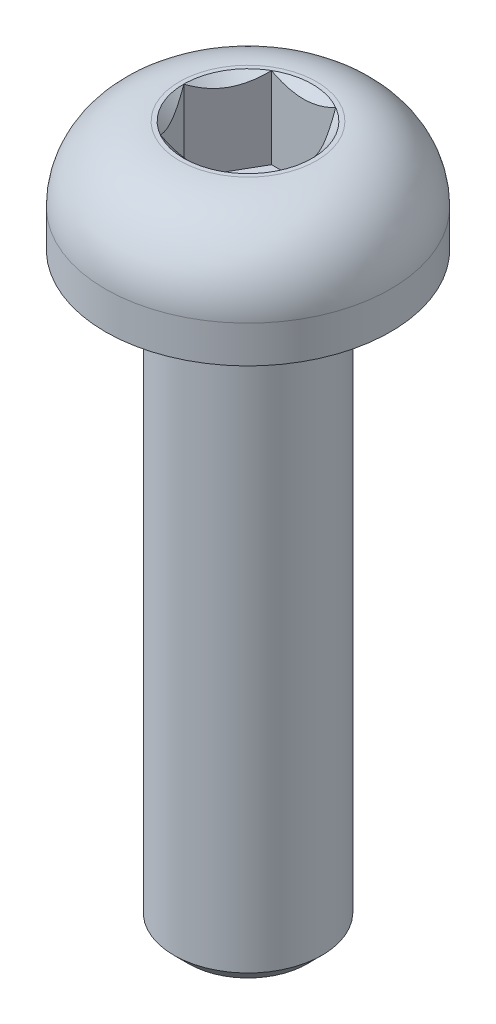
from build123d import *

# Parameters (mm, degrees)
CUT_EXTRUDE1_DEPTH  = 1.1
BOSS_EXTRUDE1_REACH = 12.334
BOSS_EXTRUDE1_START = -0.5
SKETCH2_3_R         = 1.309481769


with BuildPart() as part:
    # Sketch1 → Revolve1 (revolve)
    with BuildSketch(Plane(origin=(0, 0, 0), x_dir=(0, 0, -1), z_dir=(1, 0, 0))):
        with BuildLine():
            Line((0, -7.95), (0.8, -7.95))
            Line((0.8, -7.95), (1, -7.75))
            Line((1, -7.75), (1, -0.15))
            ThreePointArc((1, -0.15), (1.043933983, -0.043933983), (1.15, 0))
            Line((1.15, 0), (1.925, 0))
            Line((1.925, 0), (1.925, 0.5))
            ThreePointArc((1.925, 0.5), (1.632106781, 1.207106781), (0.925, 1.5))
            Line((0.925, 1.5), (0.8675, 1.5))
            Line((0.8675, 1.5), (0.75, 1.3825))
            Line((0.75, 1.3825), (0.75, 0.5825))
            Line((0.75, 0.5825), (0, 0.381538106))
            Line((0, 0.381538106), (0, -7.95))
        make_face()
    revolve(axis=Axis((0, 2.837665271, 0), (0, -1, 0)))

    # Sketch2 → Cut-Extrude1 (cut)
    with BuildSketch(Plane(origin=(0, 1.5, 0), x_dir=(1, 0, 0), z_dir=(0, 1, 0))):
        Polygon((-0.433012702, -0.75), (0.433012702, -0.75), (0.866025404, 0), (0.433012702, 0.75), (-0.433012702, 0.75), (-0.866025404, 0), align=None)
    extrude(amount=-CUT_EXTRUDE1_DEPTH, mode=Mode.SUBTRACT)

    # Boss-Extrude1: up to this cone (the profile starts inside it)
    boss_extrude1_end = Plane(origin=(0, 1, 0), z_dir=(0, 1, 0)).offset(-0.618460894) * Cone(3.732e-06, 58.819334231, 15.760592106, align=(Align.CENTER, Align.CENTER, Align.MIN), mode=Mode.PRIVATE)
    # Sketch2<3> → Boss-Extrude1 (add, up to the surface)
    with BuildSketch(Plane(origin=(0, 1.5, 0), x_dir=(1, 0, 0), z_dir=(0, 1, 0)).offset(BOSS_EXTRUDE1_START), mode=Mode.PRIVATE) as boss_extrude1_sk1:
        Circle(SKETCH2_3_R)
        Polygon((0.433012702, -0.75), (0.866025404, 0), (0.433012702, 0.75), (-0.433012702, 0.75), (-0.866025404, 0), (-0.433012702, -0.75), align=None, mode=Mode.SUBTRACT)
    boss_extrude1_tool1 = extrude(boss_extrude1_sk1.sketch, amount=-BOSS_EXTRUDE1_REACH, mode=Mode.PRIVATE) & boss_extrude1_end
    add(boss_extrude1_tool1.solids().sort_by_distance((-1.272444, 1, 0))[0])


solid = part.part
